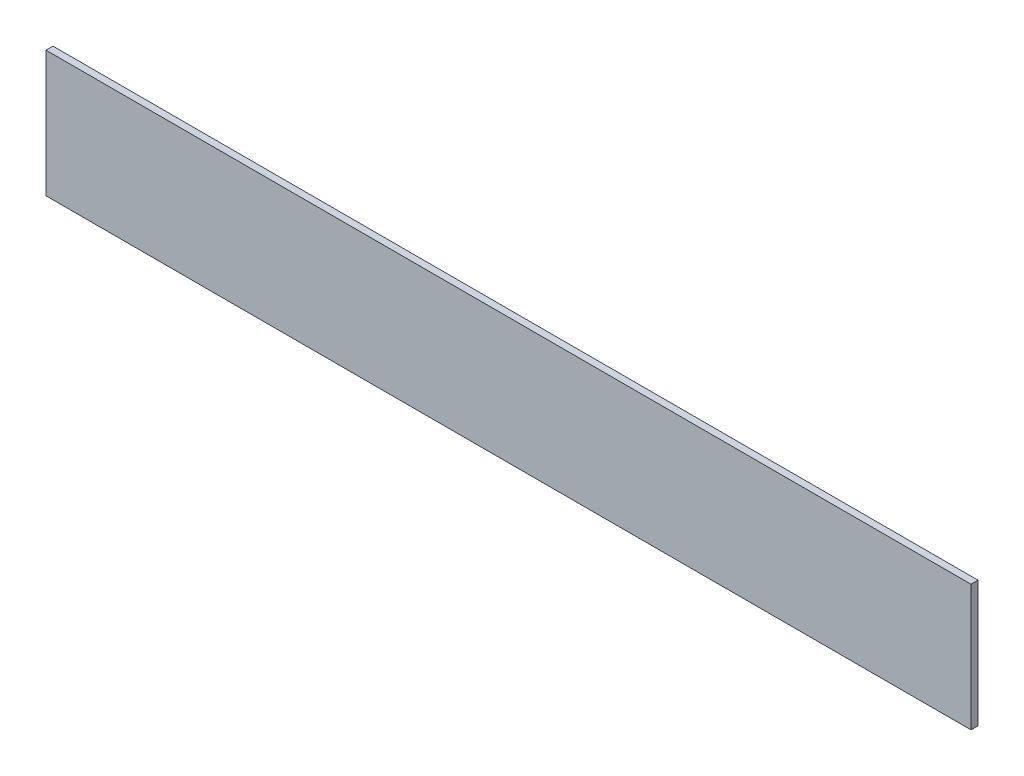
from build123d import *

# Parameters (mm, degrees)
PACK_KALIP_DUVARI_ON_1_START = -235
SKETCH1_W                    = 330
SKETCH1_H                    = 45
PACK_KALIP_DUVARI_ON_1_DEPTH = 2.5


with BuildPart() as part:
    # Sketch1 → PACK_kalip_duvari_on_1 (new body)
    with BuildSketch(Plane.XY.offset(PACK_KALIP_DUVARI_ON_1_START)):
        with Locations((350, 574.5)):
            Rectangle(SKETCH1_W, SKETCH1_H)
    extrude(amount=-PACK_KALIP_DUVARI_ON_1_DEPTH)


solid = part.part
